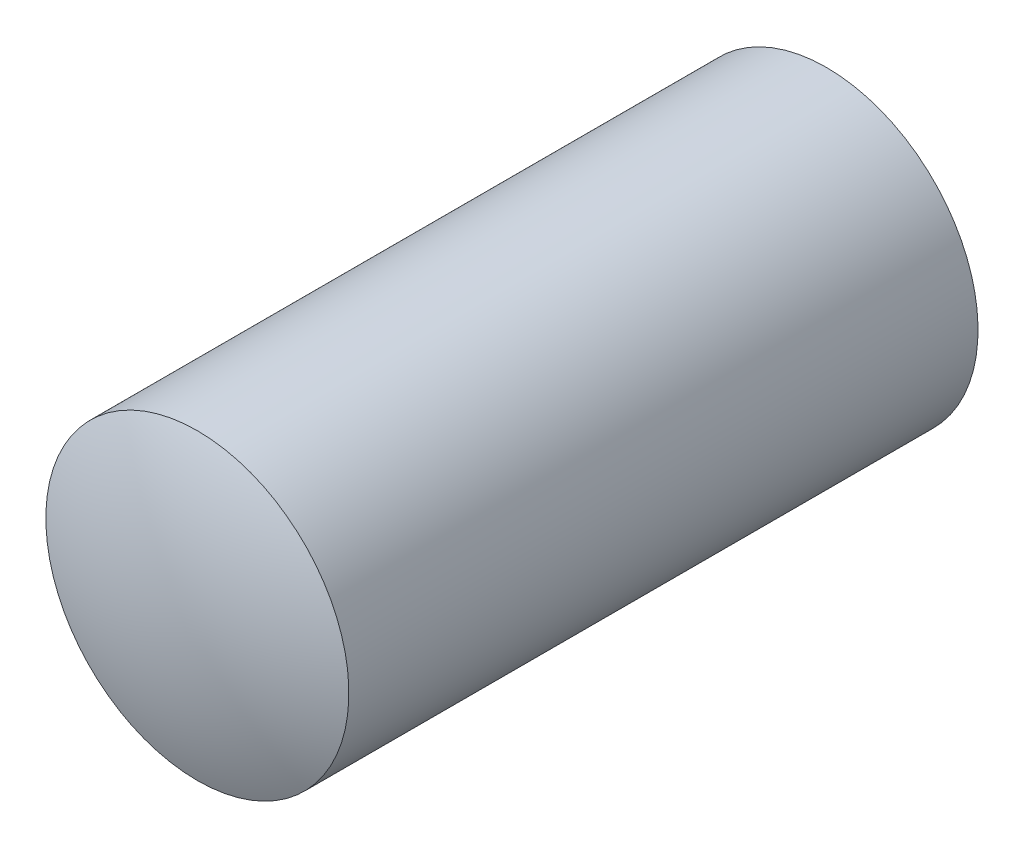
from build123d import *


with BuildPart() as part:
    # Sketch3 → Revolve1 (revolve)
    with BuildSketch(Plane(origin=(0, 0, 0), x_dir=(0, 0, -1), z_dir=(1, 0, 0)), mode=Mode.PRIVATE) as revolve1_sk:
        with BuildLine():
            Line((-1.872852234, 0), (0, 0))
            Line((0, 0), (5, 0))
            Line((5, 0), (5, 3.875))
            Line((5, 3.875), (-11.091549267, 3.875))
            ThreePointArc((-11.091549267, 3.875), (-11.675580689, 1.976490534), (-11.872852234, 0))
            Line((-11.872852234, 0), (-1.872852234, 0))
        make_face()
    revolve(revolve1_sk.sketch.rotate(Axis((0, 0, 0), (0, 0, 1)), 180), axis=Axis((0, 0, 0), (0, 0, 1)))


solid = part.part
